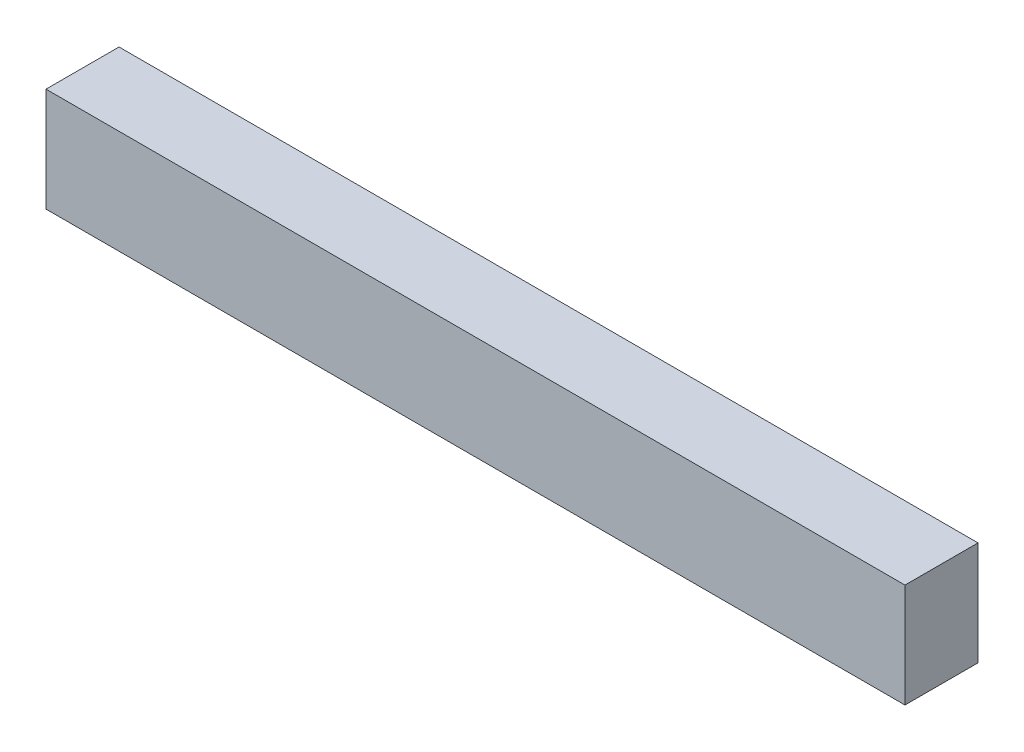
from build123d import *

# Parameters (mm, degrees)
SKETCH1_W               = 11.7602
SKETCH1_H               = 1.4224
COMPONENT_OUTLINE_DEPTH = 1


with BuildPart() as part:
    # Sketch1 → Component_Outline (new body)
    with BuildSketch(Plane.XY):
        with Locations((-0.5461, 0)):
            Rectangle(SKETCH1_W, SKETCH1_H)
    extrude(amount=COMPONENT_OUTLINE_DEPTH)


solid = part.part
